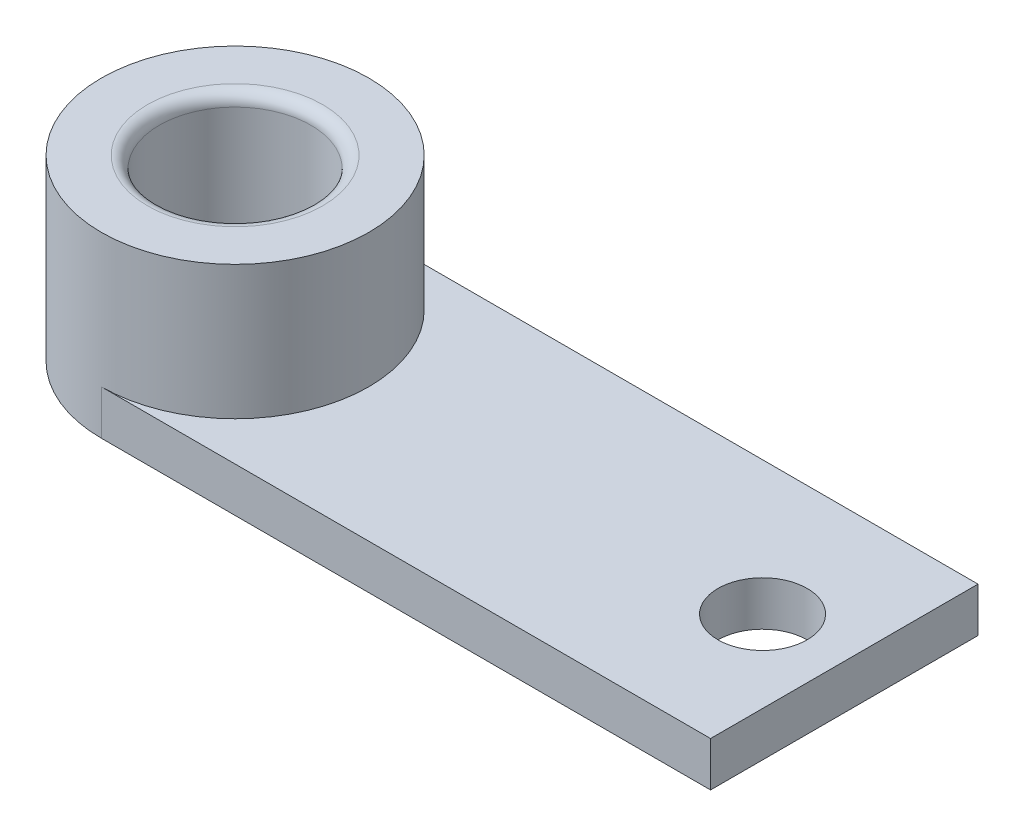
from build123d import *

# Parameters (mm, degrees)
SKETCH2_W               = 25
SKETCH2_H               = 9
BOSS_EXTRUDE3_DEPTH     = 6
SKETCH3_R               = 2.55
CUT_EXTRUDE1_DEPTH      = 5
CUT_EXTRUDE2_DEPTH      = 28.239676944
CUT_EXTRUDE2_DEPTH_BACK = 28.239676944
SKETCH4_R               = 1.5
SKETCH5_R               = 1.5
CUT_EXTRUDE3_DEPTH      = 4.5
CUT_EXTRUDE4_DEPTH      = 28.239676944
FILLET2_R               = 0.4
SKETCH8_R               = 1
CUT_EXTRUDE5_DEPTH      = 28.239676944


with BuildPart() as part:
    # Sketch2 → Boss-Extrude3 (new body)
    with BuildSketch(Plane(origin=(0, 0, 0), x_dir=(1, 0, 0), z_dir=(0, 1, 0))):
        with Locations((12.5, 4.5)):
            Rectangle(SKETCH2_W, SKETCH2_H)
    extrude(amount=BOSS_EXTRUDE3_DEPTH)

    # Sketch3 → Cut-Extrude1 (cut)
    with BuildSketch(Plane(origin=(0, 6, 0), x_dir=(1, 0, 0), z_dir=(0, 1, 0))):
        with Locations(Location((4.5, 4.5, 0), (0, 0, 270))):
            Circle(SKETCH3_R)
    extrude(amount=-CUT_EXTRUDE1_DEPTH, mode=Mode.SUBTRACT)

    # Sketch4 → Cut-Extrude2 (cut, two sides: drawn at the far end of the back side and taken through both)
    with BuildSketch(Plane(origin=(0, 6, 0), x_dir=(1, 0, 0), z_dir=(0, 1, 0)).offset(-CUT_EXTRUDE2_DEPTH_BACK)):
        with Locations(Location((22.25, 4.5, 0), (0, 0, 270))):
            Circle(SKETCH4_R)
    extrude(amount=CUT_EXTRUDE2_DEPTH + CUT_EXTRUDE2_DEPTH_BACK, mode=Mode.SUBTRACT)

    # Sketch5 → Cut-Extrude3 (cut)
    with BuildSketch(Plane(origin=(0, 6, 0), x_dir=(1, 0, 0), z_dir=(0, 1, 0))):
        with BuildLine():
            Line((25, 9), (4.5, 9))
            ThreePointArc((4.5, 9), (7.681980515, 7.681980515), (9, 4.5))
            ThreePointArc((9, 4.5), (7.681980515, 1.318019485), (4.5, 0))
            Line((4.5, 0), (25, 0))
            Line((25, 0), (25, 9))
        make_face()
        with Locations(Location((22.25, 4.5, 0), (0, 0, 270))):
            Circle(SKETCH5_R, mode=Mode.SUBTRACT)
    extrude(amount=-CUT_EXTRUDE3_DEPTH, mode=Mode.SUBTRACT)

    # Sketch6 → Cut-Extrude4 (cut, through all)
    with BuildSketch(Plane(origin=(0, 6, 0), x_dir=(1, 0, 0), z_dir=(0, 1, 0))):
        with BuildLine():
            ThreePointArc((0, 4.5), (1.318019485, 7.681980515), (4.5, 9))
            Line((4.5, 9), (0, 9))
            Line((0, 9), (0, 4.5))
        make_face()
        with BuildLine():
            ThreePointArc((4.5, 0), (1.318019485, 1.318019485), (0, 4.5))
            Line((0, 4.5), (0, 0))
            Line((0, 0), (4.5, 0))
        make_face()
    extrude(amount=-CUT_EXTRUDE4_DEPTH, mode=Mode.SUBTRACT)

    # Fillet2
    fillet2_edges = [part.edges().sort_by_distance(p)[0] for p in [
        (4.5, 6, -7.05),
    ]]
    fillet(fillet2_edges, radius=FILLET2_R)

    # Sketch8 → Cut-Extrude5 (cut, through all)
    with BuildSketch(Plane.XZ):
        with Locations(Location((4.5, -4.5, 0), (0, 0, 270))):
            Circle(SKETCH8_R)
    extrude(amount=-CUT_EXTRUDE5_DEPTH, mode=Mode.SUBTRACT)


solid = part.part
